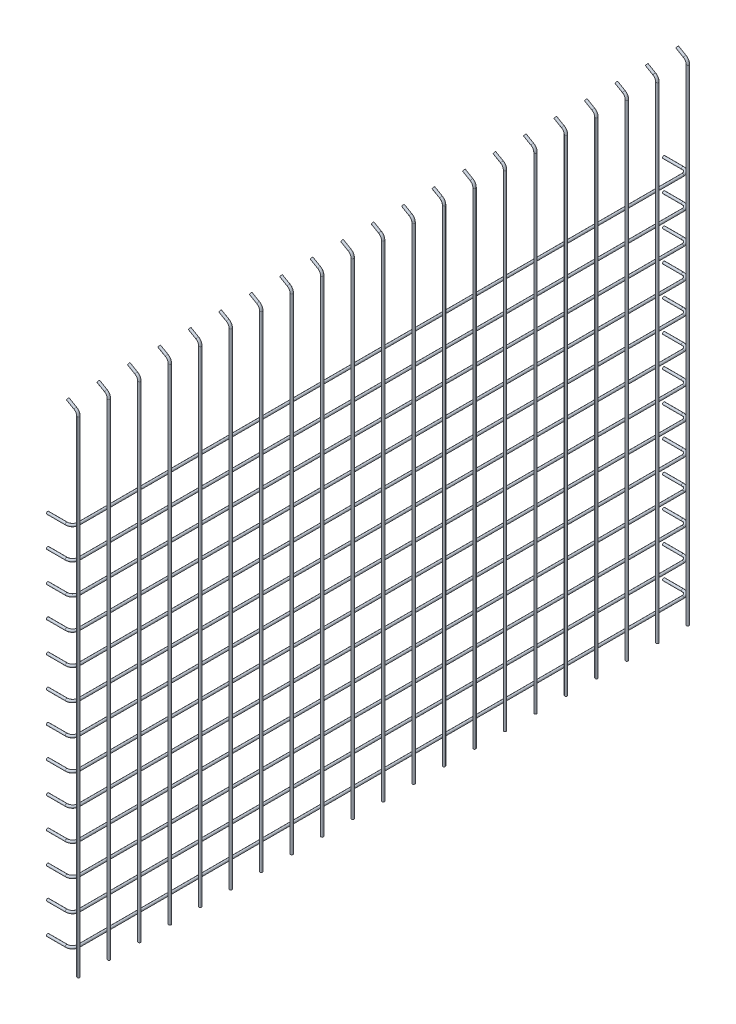
from build123d import *

# Parameters (mm, degrees)
SKETCH_2_R             = 2
PATTERN_LINEAR_1_COUNT = 11
PATTERN_LINEAR_1_PITCH = 50
SKETCH_4_R             = 2
PATTERN_LINEAR_2_COUNT = 13
PATTERN_LINEAR_2_PITCH = 50


with BuildPart() as part:
    # По траектории1: sweep along a path in Эскиз1
    with BuildLine(Plane.XY) as sweep_1_path:
        Line((-2, 0), (-2, 796.992958445))
        ThreePointArc((-2, 796.992958445), (-3.339745962, 801.992958445), (-7, 805.653212483))
        Line((-7, 805.653212483), (-19.320508076, 812.766461137))
    # Эскиз2 → По траектории1 (sweep)
    with BuildSketch(Plane(origin=(0, 0, 0), x_dir=(1, 0, 0), z_dir=(0, 1, 0))):
        with Locations((-2, 0)):
            Circle(SKETCH_2_R)
    sweep(path=sweep_1_path.line)


with BuildPart() as pattern_linear_1_1:
    # Линейный массив1: pattern copy
    add(part.part.moved(Location(Vector(0, 0, -1) * (1 * PATTERN_LINEAR_1_PITCH))))


with BuildPart() as pattern_linear_1_2:
    # Линейный массив1: pattern copy
    add(part.part.moved(Location(Vector(0, 0, -1) * (2 * PATTERN_LINEAR_1_PITCH))))


with BuildPart() as pattern_linear_1_3:
    # Линейный массив1: pattern copy
    add(part.part.moved(Location(Vector(0, 0, -1) * (3 * PATTERN_LINEAR_1_PITCH))))


with BuildPart() as pattern_linear_1_4:
    # Линейный массив1: pattern copy
    add(part.part.moved(Location(Vector(0, 0, -1) * (4 * PATTERN_LINEAR_1_PITCH))))


with BuildPart() as pattern_linear_1_5:
    # Линейный массив1: pattern copy
    add(part.part.moved(Location(Vector(0, 0, -1) * (5 * PATTERN_LINEAR_1_PITCH))))


with BuildPart() as pattern_linear_1_6:
    # Линейный массив1: pattern copy
    add(part.part.moved(Location(Vector(0, 0, -1) * (6 * PATTERN_LINEAR_1_PITCH))))


with BuildPart() as pattern_linear_1_7:
    # Линейный массив1: pattern copy
    add(part.part.moved(Location(Vector(0, 0, -1) * (7 * PATTERN_LINEAR_1_PITCH))))


with BuildPart() as pattern_linear_1_8:
    # Линейный массив1: pattern copy
    add(part.part.moved(Location(Vector(0, 0, -1) * (8 * PATTERN_LINEAR_1_PITCH))))


with BuildPart() as pattern_linear_1_9:
    # Линейный массив1: pattern copy
    add(part.part.moved(Location(Vector(0, 0, -1) * (9 * PATTERN_LINEAR_1_PITCH))))


with BuildPart() as pattern_linear_1_10:
    # Линейный массив1: pattern copy
    add(part.part.moved(Location(Vector(0, 0, -1) * (10 * PATTERN_LINEAR_1_PITCH))))


with BuildPart() as body_12:
    # Зеркальное отражение1: mirrored copy
    add(pattern_linear_1_10.part.mirror(Plane.XY))


with BuildPart() as body_13:
    # Mirror 1 2: mirrored copy
    add(pattern_linear_1_9.part.mirror(Plane.XY))


with BuildPart() as body_14:
    # Mirror 1 3: mirrored copy
    add(pattern_linear_1_8.part.mirror(Plane.XY))


with BuildPart() as body_15:
    # Mirror 1 4: mirrored copy
    add(pattern_linear_1_7.part.mirror(Plane.XY))


with BuildPart() as body_16:
    # Mirror 1 5: mirrored copy
    add(pattern_linear_1_6.part.mirror(Plane.XY))


with BuildPart() as body_17:
    # Mirror 1 6: mirrored copy
    add(pattern_linear_1_5.part.mirror(Plane.XY))


with BuildPart() as body_18:
    # Mirror 1 7: mirrored copy
    add(pattern_linear_1_3.part.mirror(Plane.XY))


with BuildPart() as body_19:
    # Mirror 1 8: mirrored copy
    add(pattern_linear_1_2.part.mirror(Plane.XY))


with BuildPart() as body_20:
    # Mirror 1 9: mirrored copy
    add(pattern_linear_1_1.part.mirror(Plane.XY))


with BuildPart() as body_21:
    # Mirror 1 10: mirrored copy
    add(pattern_linear_1_4.part.mirror(Plane.XY))


with BuildPart() as body_22:
    # По траектории2: sweep along a path in Эскиз3
    with BuildLine(Plane(origin=(0, 40, 0), x_dir=(1, 0, 0), z_dir=(0, 1, 0))) as sweep_2_path:
        Line((-47, 505.5), (-16, 505.5))
        ThreePointArc((-16, 505.5), (-8.928932188, 502.571067812), (-6, 495.5))
        Line((-6, 495.5), (-6, -495.5))
        ThreePointArc((-6, -495.5), (-8.928932188, -502.571067812), (-16, -505.5))
        Line((-16, -505.5), (-47, -505.5))
    # Эскиз4 → По траектории2 (sweep)
    with BuildSketch(Plane.ZY.offset(47)):
        with Locations((-505.5, 40)):
            Circle(SKETCH_4_R)
    sweep(path=sweep_2_path.line)


with BuildPart() as pattern_linear_2_1:
    # Линейный массив2: pattern copy
    add(body_22.part.moved(Location(Vector(0, 1, 0) * (1 * PATTERN_LINEAR_2_PITCH))))


with BuildPart() as pattern_linear_2_2:
    # Линейный массив2: pattern copy
    add(body_22.part.moved(Location(Vector(0, 1, 0) * (2 * PATTERN_LINEAR_2_PITCH))))


with BuildPart() as pattern_linear_2_3:
    # Линейный массив2: pattern copy
    add(body_22.part.moved(Location(Vector(0, 1, 0) * (3 * PATTERN_LINEAR_2_PITCH))))


with BuildPart() as pattern_linear_2_4:
    # Линейный массив2: pattern copy
    add(body_22.part.moved(Location(Vector(0, 1, 0) * (4 * PATTERN_LINEAR_2_PITCH))))


with BuildPart() as pattern_linear_2_5:
    # Линейный массив2: pattern copy
    add(body_22.part.moved(Location(Vector(0, 1, 0) * (5 * PATTERN_LINEAR_2_PITCH))))


with BuildPart() as pattern_linear_2_6:
    # Линейный массив2: pattern copy
    add(body_22.part.moved(Location(Vector(0, 1, 0) * (6 * PATTERN_LINEAR_2_PITCH))))


with BuildPart() as pattern_linear_2_7:
    # Линейный массив2: pattern copy
    add(body_22.part.moved(Location(Vector(0, 1, 0) * (7 * PATTERN_LINEAR_2_PITCH))))


with BuildPart() as pattern_linear_2_8:
    # Линейный массив2: pattern copy
    add(body_22.part.moved(Location(Vector(0, 1, 0) * (8 * PATTERN_LINEAR_2_PITCH))))


with BuildPart() as pattern_linear_2_9:
    # Линейный массив2: pattern copy
    add(body_22.part.moved(Location(Vector(0, 1, 0) * (9 * PATTERN_LINEAR_2_PITCH))))


with BuildPart() as pattern_linear_2_10:
    # Линейный массив2: pattern copy
    add(body_22.part.moved(Location(Vector(0, 1, 0) * (10 * PATTERN_LINEAR_2_PITCH))))


with BuildPart() as pattern_linear_2_11:
    # Линейный массив2: pattern copy
    add(body_22.part.moved(Location(Vector(0, 1, 0) * (11 * PATTERN_LINEAR_2_PITCH))))


with BuildPart() as pattern_linear_2_12:
    # Линейный массив2: pattern copy
    add(body_22.part.moved(Location(Vector(0, 1, 0) * (12 * PATTERN_LINEAR_2_PITCH))))


solid = Compound([part.part, pattern_linear_1_1.part, pattern_linear_1_2.part, pattern_linear_1_3.part, pattern_linear_1_4.part, pattern_linear_1_5.part, pattern_linear_1_6.part, pattern_linear_1_7.part, pattern_linear_1_8.part, pattern_linear_1_9.part, pattern_linear_1_10.part, body_12.part, body_13.part, body_14.part, body_15.part, body_16.part, body_17.part, body_18.part, body_19.part, body_20.part, body_21.part, body_22.part, pattern_linear_2_1.part, pattern_linear_2_2.part, pattern_linear_2_3.part, pattern_linear_2_4.part, pattern_linear_2_5.part, pattern_linear_2_6.part, pattern_linear_2_7.part, pattern_linear_2_8.part, pattern_linear_2_9.part, pattern_linear_2_10.part, pattern_linear_2_11.part, pattern_linear_2_12.part])
